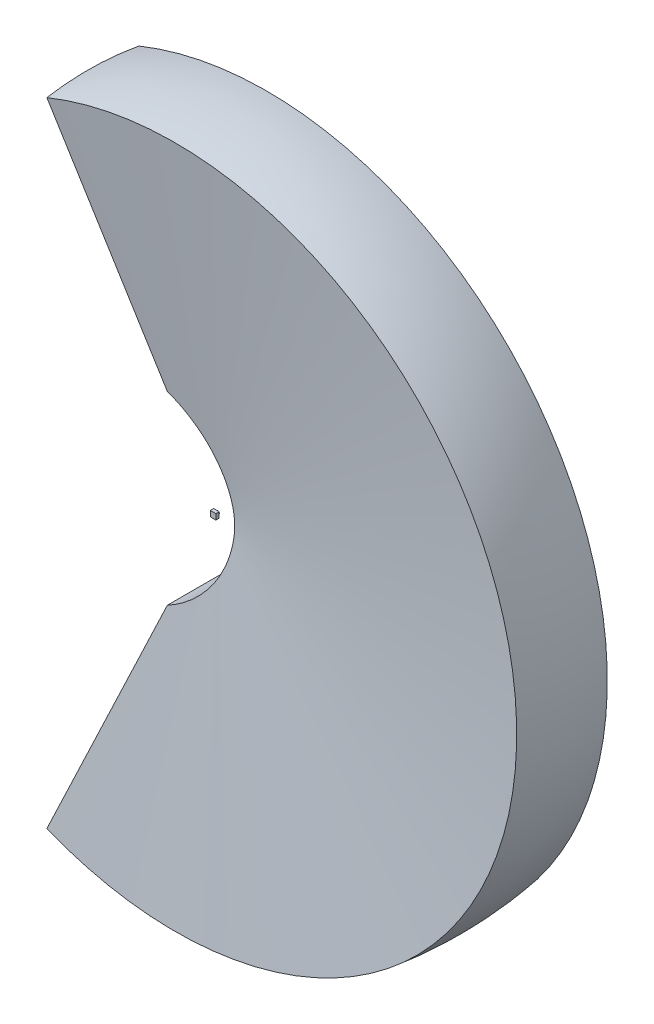
from build123d import *

# Parameters (mm, degrees)
SCHIZZO1_W                    = 65
SCHIZZO1_H                    = 65
ESTRUSIONE_ESTRUSIONE1_DEPTH  = 39.5
TAGLIO_ESTRUSIONE4_REACH      = 5711.959
TAGLIO_ESTRUSIONE4_END_RADIUS = 4000
SCHIZZO8_W                    = 775.2
SCHIZZO8_H                    = 1000
SCHIZZO8_W_2                  = 524.8
TAGLIA_RIVOLUZIONE1_ANGLE     = 135.87
TAGLIO_ESTRUSIONE11_REACH     = 5758.285
SCHIZZO16_R                   = 1200


with BuildPart() as part:
    # Schizzo1 → Estrusione-Estrusione1 (new body)
    with BuildSketch(Plane.XY):
        Rectangle(SCHIZZO1_W, SCHIZZO1_H)
    extrude(amount=ESTRUSIONE_ESTRUSIONE1_DEPTH)

    # Schizzo2 → Rivoluzione1 (revolve)
    with BuildSketch(Plane(origin=(0, 0, 0), x_dir=(1, 0, 0), z_dir=(0, 1, 0))):
        with BuildLine():
            Line((0, 0), (0, 20.5))
            Line((0, 20.5), (12.479983974, 20.5))
            ThreePointArc((12.479983974, 20.5), (20.922710333, 11.757558943), (24, 0))
            Line((24, 0), (0, 0))
        make_face()
    revolve(axis=Axis((0, 0, 0), (0, 0, -1)))


with BuildPart() as body_2:
    # Schizzo5 → Rivoluzione5 (revolve)
    with BuildSketch(Plane(origin=(0, 0, 0), x_dir=(1, 0, 0), z_dir=(0, 1, 0))):
        with BuildLine():
            Line((32.5, 3.509501771), (3970.184606565, -479.977373621))
            ThreePointArc((3970.184606565, -479.977373621), (3999.74044582, 53.06715998), (3958.048402938, 585.3))
            Line((3958.048402938, 585.3), (451.426834996, 585.3))
            Line((451.426834996, 585.3), (20.15926203, 33.302678747))
            ThreePointArc((20.15926203, 33.302678747), (30.251575463, 20.03061284), (32.5, 3.509501771))
        make_face()
    revolve(axis=Axis((0, 0, 992.5), (0, 0, -1)))

    # Taglio-Estrusione4: up to this sphere (the profile starts inside it)
    taglio_estrusione4_end = Location((0, 0, -7.5)) * Sphere(TAGLIO_ESTRUSIONE4_END_RADIUS, mode=Mode.PRIVATE)
    # Schizzo8 → Taglio-Estrusione4 (cut, up to the surface)
    with BuildSketch(Plane(origin=(32.5, 0, 0), x_dir=(0, 0, -1), z_dir=(1, 0, 0)), mode=Mode.PRIVATE) as taglio_estrusione4_sk1:
        with Locations((-427.1, 0)):
            Rectangle(SCHIZZO8_W, SCHIZZO8_H)
    taglio_estrusione4_tool1 = extrude(taglio_estrusione4_sk1.sketch, amount=-TAGLIO_ESTRUSIONE4_REACH, mode=Mode.PRIVATE) & taglio_estrusione4_end
    add(taglio_estrusione4_tool1.solids().sort_by_distance((32.5, 0, 427.1))[0], mode=Mode.SUBTRACT)
    # Schizzo8 → Taglio-Estrusione4 (cut, up to the surface)
    with BuildSketch(Plane(origin=(32.5, 0, 0), x_dir=(0, 0, -1), z_dir=(1, 0, 0)), mode=Mode.PRIVATE) as taglio_estrusione4_sk2:
        with Locations((322.9, 0)):
            Rectangle(SCHIZZO8_W_2, SCHIZZO8_H)
    taglio_estrusione4_tool2 = extrude(taglio_estrusione4_sk2.sketch, amount=-TAGLIO_ESTRUSIONE4_REACH, mode=Mode.PRIVATE) & taglio_estrusione4_end
    add(taglio_estrusione4_tool2.solids().sort_by_distance((32.5, 0, -322.9))[0], mode=Mode.SUBTRACT)

    # Schizzo11 → Taglia-Rivoluzione1 (revolve, symmetric, cut)
    with BuildSketch(Plane(origin=(0, 0, 0), x_dir=(1, 0, 0), z_dir=(0, 1, 0))) as taglia_rivoluzione1_sk:
        Polygon((0, -514.7), (-40000, -514.7), (-40000, 585.3), (0, 585.3), (0, 60.5), (-202.66, 60.5), (-202.66, -39.5), (0, -39.5), align=None)
    revolve(axis=Axis((0, 0, 992.5), (0, 0, -1)), revolution_arc=TAGLIA_RIVOLUZIONE1_ANGLE / 2, mode=Mode.SUBTRACT)
    revolve(taglia_rivoluzione1_sk.sketch, axis=Axis((0, 0, 992.5), (0, 0, 1)), revolution_arc=TAGLIA_RIVOLUZIONE1_ANGLE / 2, mode=Mode.SUBTRACT)

    # Taglio-Estrusione11: up to this cone (the profile starts outside it)
    taglio_estrusione11_end = Plane(origin=(0, 0, -585.3), z_dir=(0, 0, 1)).offset(577.800001) * Cone(8.144e-06, 42195.736678139, 5180.984999, align=(Align.CENTER, Align.CENTER, Align.MIN), mode=Mode.PRIVATE)
    # Schizzo16 → Taglio-Estrusione11 (cut, up to the surface)
    with BuildSketch(Plane(origin=(0, 0, -585.3), x_dir=(-1, 0, 0), z_dir=(0, 0, -1)), mode=Mode.PRIVATE) as taglio_estrusione11_sk1:
        with Locations((967.5, 0)):
            Circle(SCHIZZO16_R)
    taglio_estrusione11_tool1 = extrude(taglio_estrusione11_sk1.sketch, amount=-TAGLIO_ESTRUSIONE11_REACH, mode=Mode.PRIVATE) - taglio_estrusione11_end
    add(taglio_estrusione11_tool1.solids().sort_by_distance((-967.5, 0, -585.3))[0], mode=Mode.SUBTRACT)


solid = Compound([part.part, body_2.part])
